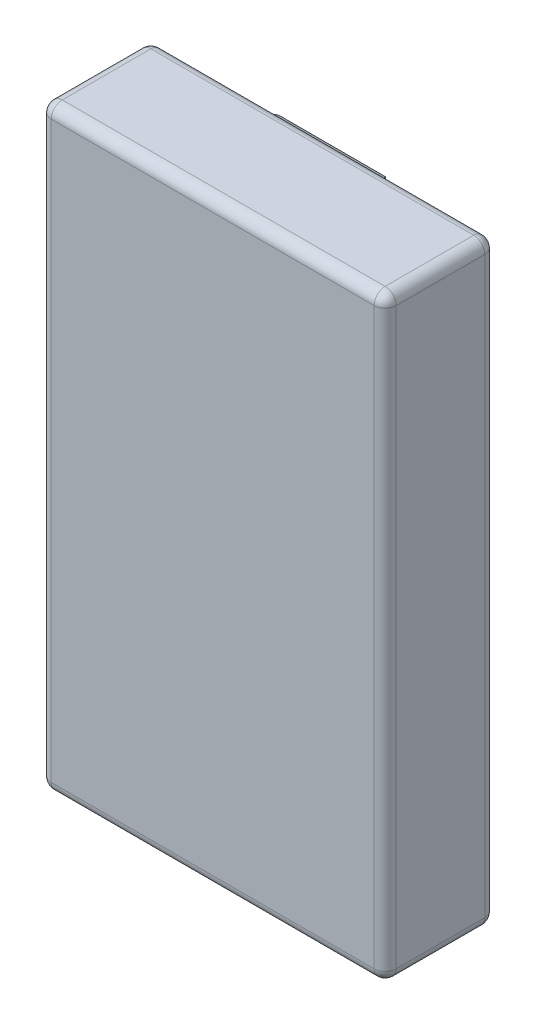
from build123d import *

# Parameters (mm, degrees)
SKETCH_1_W      = 31.172738554
SKETCH_1_H      = 53.896192989
EXTRUDE_1_DEPTH = 10
SKETCH_2_W      = 10
SKETCH_2_H      = 5
EXTRUDE_3_DEPTH = 1.2
FILLET_1_R      = 1
FILLET_2_R      = 1


with BuildPart() as part:
    # 草圖1 → 填料-伸長1 (new body)
    with BuildSketch(Plane.XY):
        with Locations((0, -43.60381631)):
            Rectangle(SKETCH_1_W, SKETCH_1_H)
    extrude(amount=EXTRUDE_1_DEPTH)

    # 草圖2 → 填料-伸長3 (add)
    with BuildSketch(Plane.XY):
        with Locations((0, -20.178917106)):
            Rectangle(SKETCH_2_W, SKETCH_2_H)
    extrude(amount=-EXTRUDE_3_DEPTH)

    # 圓角1
    fillet_1_edges = [part.edges().sort_by_distance(p)[0] for p in [
        (-5, -20.178917106, -1.2),
        (0, -17.678917106, -1.2),
        (5, -20.178917106, -1.2),
        (0, -22.678917106, -1.2),
    ]]
    fillet(fillet_1_edges, radius=FILLET_1_R)

    # 圓角2
    fillet_2_edges = [part.edges().sort_by_distance(p)[0] for p in [
        (-15.586369277, -43.60381631, 10),
        (0, -70.551912804, 10),
        (15.586369277, -43.60381631, 10),
        (0, -70.551912804, 0),
        (-15.586369277, -43.60381631, 0),
        (0, -16.655719815, 0),
        (15.586369277, -43.60381631, 0),
        (15.586369277, -70.551912804, 5),
        (-15.586369277, -70.551912804, 5),
        (-15.586369277, -16.655719815, 5),
        (15.586369277, -16.655719815, 5),
        (0, -16.655719815, 10),
    ]]
    fillet(fillet_2_edges, radius=FILLET_2_R)


solid = part.part
